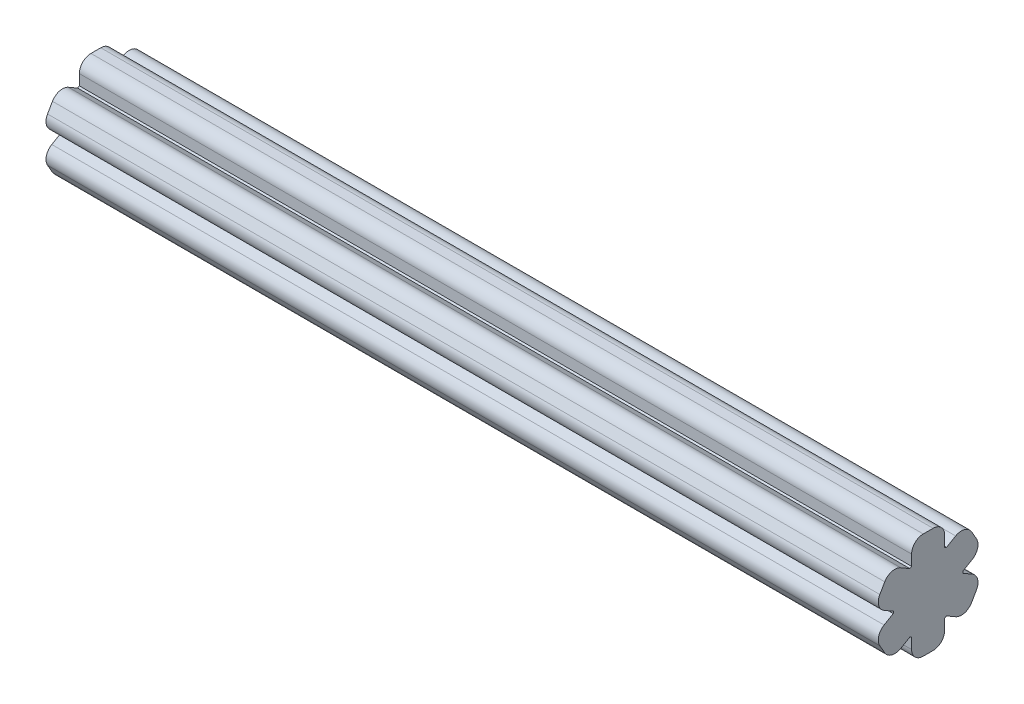
from build123d import *

# Parameters (mm, degrees)
SKETCH2_R            = 25.79
BOSS_EXTRUDE2_DEPTH  = 358
BOSS_EXTRUDE10_DEPTH = 358
SKETCH18_R           = 25.79
CUT_EXTRUDE5_DEPTH   = 358


with BuildPart() as part:
    # Sketch2 → Boss-Extrude2 (new body)
    with BuildSketch(Plane(origin=(0, 0, 0), x_dir=(0, 0, -1), z_dir=(1, 0, 0))):
        with Locations(Location((0, 0, 0), (0, 0, 180))):
            Circle(SKETCH2_R)
        with BuildLine():
            Line((9.521706212, 3.055668636), (16.449909442, 7.055668636))
            Line((16.449909442, 7.055668636), (14.335343, 10.718205149))
            Line((14.335343, 10.718205149), (7.40713977, 6.718205149))
            ThreePointArc((7.40713977, 6.718205149), (5, 8.660254038), (2.114566442, 9.773873785))
            Line((2.114566442, 9.773873785), (2.114566442, 17.773873785))
            Line((2.114566442, 17.773873785), (-2.114566442, 17.773873785))
            Line((-2.114566442, 17.773873785), (-2.114566442, 9.773873785))
            ThreePointArc((-2.114566442, 9.773873785), (-5, 8.660254038), (-7.40713977, 6.718205149))
            Line((-7.40713977, 6.718205149), (-14.335343, 10.718205149))
            Line((-14.335343, 10.718205149), (-16.449909442, 7.055668636))
            Line((-16.449909442, 7.055668636), (-9.521706212, 3.055668636))
            ThreePointArc((-9.521706212, 3.055668636), (-10, 0), (-9.521706212, -3.055668636))
            Line((-9.521706212, -3.055668636), (-16.449909442, -7.055668636))
            Line((-16.449909442, -7.055668636), (-14.335343, -10.718205149))
            Line((-14.335343, -10.718205149), (-7.40713977, -6.718205149))
            ThreePointArc((-7.40713977, -6.718205149), (-5, -8.660254038), (-2.114566442, -9.773873785))
            Line((-2.114566442, -9.773873785), (-2.114566442, -17.773873785))
            Line((-2.114566442, -17.773873785), (2.114566442, -17.773873785))
            Line((2.114566442, -17.773873785), (2.114566442, -9.773873785))
            ThreePointArc((2.114566442, -9.773873785), (5, -8.660254038), (7.40713977, -6.718205149))
            Line((7.40713977, -6.718205149), (14.335343, -10.718205149))
            Line((14.335343, -10.718205149), (16.449909442, -7.055668636))
            Line((16.449909442, -7.055668636), (9.521706212, -3.055668636))
            ThreePointArc((9.521706212, -3.055668636), (10, 0), (9.521706212, 3.055668636))
        make_face(mode=Mode.SUBTRACT)
    extrude(amount=BOSS_EXTRUDE2_DEPTH)

    # Sketch10 → Boss-Extrude10 (add)
    with BuildSketch(Plane.ZY):
        with BuildLine():
            Line((-7.114566442, -13.205413448), (-7.114566442, -17.773873785))
            ThreePointArc((-7.114566442, -17.773873785), (-5.650100348, -21.309407691), (-2.114566442, -22.773873785))
            Line((-2.114566442, -22.773873785), (2.114566442, -22.773873785))
            ThreePointArc((2.114566442, -22.773873785), (5.650100348, -21.309407691), (7.114566442, -17.773873785))
            Line((7.114566442, -17.773873785), (7.114566442, -13.205413448))
            ThreePointArc((7.114566442, -13.205413448), (7.5, -12.990381057), (7.878940293, -12.764102))
            Line((7.878940293, -12.764102), (11.835343, -15.048332168))
            ThreePointArc((11.835343, -15.048332168), (15.629438226, -15.547834281), (18.665470019, -13.218205149))
            Line((18.665470019, -13.218205149), (20.780036461, -9.555668636))
            ThreePointArc((20.780036461, -9.555668636), (21.279538574, -5.76157341), (18.949909442, -2.725541617))
            Line((18.949909442, -2.725541617), (14.993506735, -0.441311448))
            ThreePointArc((14.993506735, -0.441311448), (15, 0), (14.993506735, 0.441311448))
            Line((14.993506735, 0.441311448), (18.949909442, 2.725541617))
            ThreePointArc((18.949909442, 2.725541617), (21.279538574, 5.76157341), (20.780036461, 9.555668636))
            Line((20.780036461, 9.555668636), (18.665470019, 13.218205149))
            ThreePointArc((18.665470019, 13.218205149), (15.629438226, 15.547834281), (11.835343, 15.048332168))
            Line((11.835343, 15.048332168), (7.878940293, 12.764102))
            ThreePointArc((7.878940293, 12.764102), (7.5, 12.990381057), (7.114566442, 13.205413448))
            Line((7.114566442, 13.205413448), (7.114566442, 17.773873785))
            ThreePointArc((7.114566442, 17.773873785), (5.650100348, 21.309407691), (2.114566442, 22.773873785))
            Line((2.114566442, 22.773873785), (-2.114566442, 22.773873785))
            ThreePointArc((-2.114566442, 22.773873785), (-5.650100348, 21.309407691), (-7.114566442, 17.773873785))
            Line((-7.114566442, 17.773873785), (-7.114566442, 13.205413448))
            ThreePointArc((-7.114566442, 13.205413448), (-7.5, 12.990381057), (-7.878940293, 12.764102))
            Line((-7.878940293, 12.764102), (-11.835343, 15.048332168))
            ThreePointArc((-11.835343, 15.048332168), (-15.629438226, 15.547834281), (-18.665470019, 13.218205149))
            Line((-18.665470019, 13.218205149), (-20.780036461, 9.555668636))
            ThreePointArc((-20.780036461, 9.555668636), (-21.279538574, 5.76157341), (-18.949909442, 2.725541617))
            Line((-18.949909442, 2.725541617), (-14.993506735, 0.441311448))
            ThreePointArc((-14.993506735, 0.441311448), (-15, 0), (-14.993506735, -0.441311448))
            Line((-14.993506735, -0.441311448), (-18.949909442, -2.725541617))
            ThreePointArc((-18.949909442, -2.725541617), (-21.279538574, -5.76157341), (-20.780036461, -9.555668636))
            Line((-20.780036461, -9.555668636), (-18.665470019, -13.218205149))
            ThreePointArc((-18.665470019, -13.218205149), (-15.629438226, -15.547834281), (-11.835343, -15.048332168))
            Line((-11.835343, -15.048332168), (-7.878940293, -12.764102))
            ThreePointArc((-7.878940293, -12.764102), (-7.5, -12.990381057), (-7.114566442, -13.205413448))
        make_face()
    extrude(amount=BOSS_EXTRUDE10_DEPTH)

    # Sketch18 → Cut-Extrude5 (cut)
    with BuildSketch(Plane.ZY):
        Circle(SKETCH18_R)
    extrude(amount=-CUT_EXTRUDE5_DEPTH, mode=Mode.SUBTRACT)


solid = part.part
